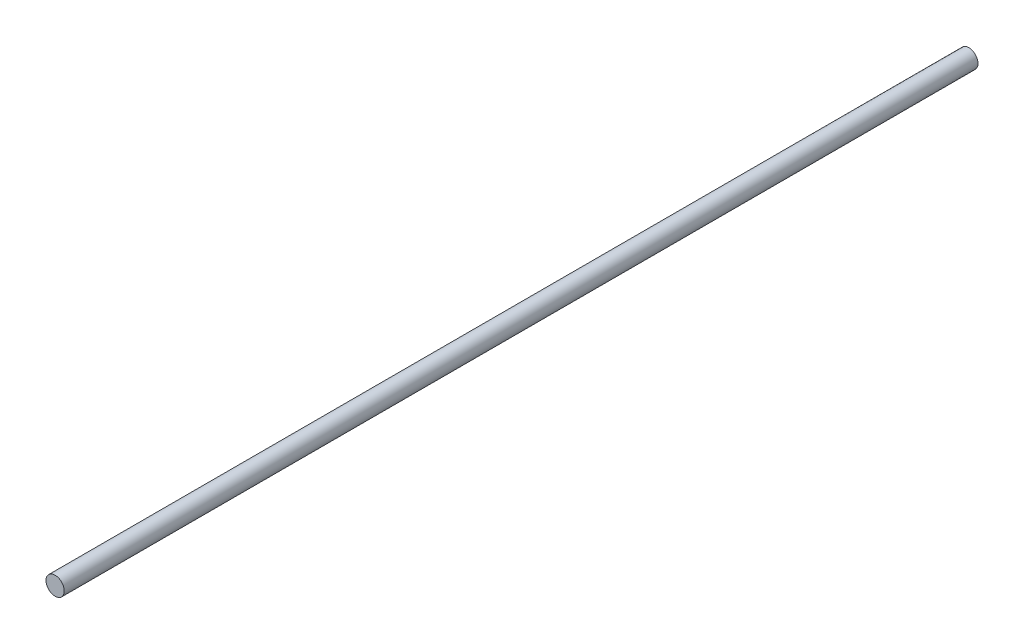
from build123d import *

# Parameters (mm, degrees)
SKETCH_1_R          = 1
EXTRUDE_1_DEPTH     = 150
CUT_EXTRUDE_START   = -50
SKETCH_3_R          = 1
CUT_EXTRUDE_1_DEPTH = 50


with BuildPart() as part:
    # 草图1 → 凸台-拉伸1 (new body)
    with BuildSketch(Plane.XY):
        Circle(SKETCH_1_R)
    extrude(amount=EXTRUDE_1_DEPTH)

    # 草图3 → 切除-拉伸1 (cut)
    with BuildSketch(Plane.XY.offset(150).offset(CUT_EXTRUDE_START)):
        Circle(SKETCH_3_R)
    extrude(amount=CUT_EXTRUDE_1_DEPTH, mode=Mode.SUBTRACT)


solid = part.part
